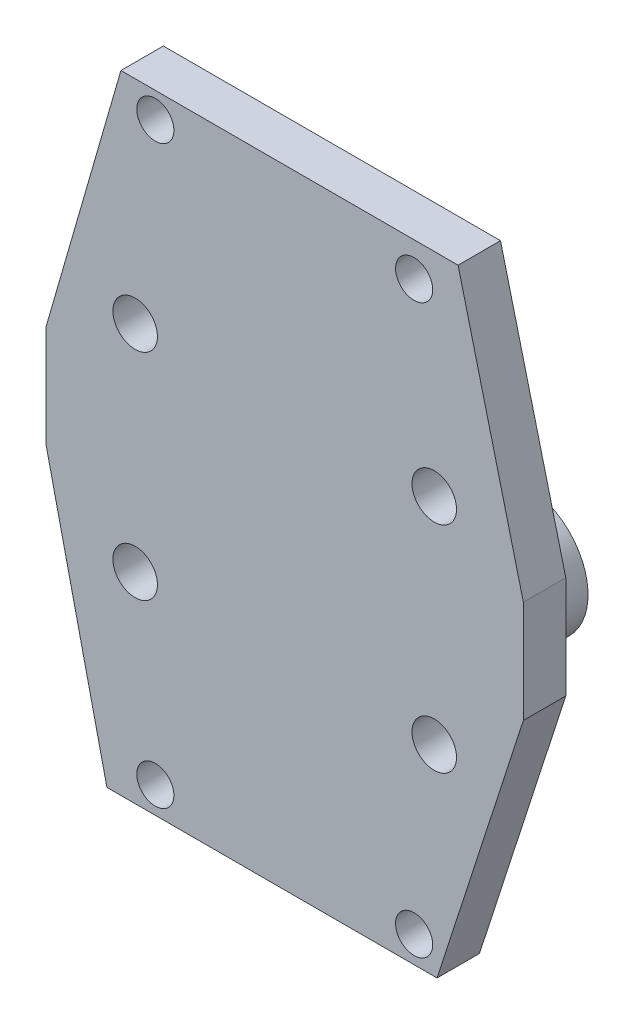
from build123d import *

# Parameters (mm, degrees)
CROQUIS1_W               = 22
CROQUIS1_H               = 55.2
SALIENTE_EXTRUIR1_DEPTH  = 4
CROQUIS2_W               = 12.1
CROQUIS2_H               = 4
CORTAR_EXTRUIR1_DEPTH    = 9.6
CROQUIS3_W               = 12.1
CROQUIS3_H               = 4
CORTAR_EXTRUIR2_DEPTH    = 9.6
CORTAR_EXTRUIR3_DEPTH    = 16
CORTAR_EXTRUIR4_START    = -16
CORTAR_EXTRUIR4_DEPTH    = 16
CROQUIS9_W               = 11.778481694
CROQUIS9_H               = 4
CORTAR_EXTRUIR5_DEPTH    = 2
CROQUIS11_W              = 4.95
CROQUIS11_H              = 4
SALIENTE_EXTRUIR3_DEPTH  = 2
CROQUIS12_W              = 4
CROQUIS12_H              = 1.8
SALIENTE_EXTRUIR4_DEPTH  = 12.1
CROQUIS13_W              = 4.95
CROQUIS13_H              = 4
SALIENTE_EXTRUIR5_DEPTH  = 2
CROQUIS14_W              = 4
CROQUIS14_H              = 1.8
SALIENTE_EXTRUIR6_DEPTH  = 12.1
CROQUIS17_W              = 4
CROQUIS17_H              = 59.2
SALIENTE_EXTRUIR8_DEPTH  = 11.5
CROQUIS18_W              = 4
CROQUIS18_H              = 59.2
SALIENTE_EXTRUIR9_DEPTH  = 11.5
CROQUIS19_R              = 1.75
CORTAR_EXTRUIR6_DEPTH    = 11.5
CORTAR_EXTRUIR7_DEPTH    = 10
CROQUIS27_W              = 12.1
CROQUIS27_H              = 55.6
CORTAR_EXTRUIR8_DEPTH    = 10
CROQUIS28_W              = 12.1
CROQUIS28_H              = 4
SALIENTE_EXTRUIR10_DEPTH = 55.6
SALIENTE_EXTRUIR11_DEPTH = 4.5
CROQUIS30_R              = 2.1
CORTAR_EXTRUIR9_DEPTH    = 10


with BuildPart() as part:
    # Croquis1 → Saliente-Extruir1 (new body)
    with BuildSketch(Plane.XY):
        with Locations((11, 27.6)):
            Rectangle(CROQUIS1_W, CROQUIS1_H)
    extrude(amount=SALIENTE_EXTRUIR1_DEPTH)

    # Croquis2 → Cortar-Extruir1 (cut)
    with BuildSketch(Plane(origin=(0, 55.2, 0), x_dir=(1, 0, 0), z_dir=(0, 1, 0))):
        with Locations((11, -2)):
            Rectangle(CROQUIS2_W, CROQUIS2_H)
    extrude(amount=-CORTAR_EXTRUIR1_DEPTH, mode=Mode.SUBTRACT)

    # Croquis3 → Cortar-Extruir2 (cut)
    with BuildSketch(Plane.XZ):
        with Locations((11, 2)):
            Rectangle(CROQUIS3_W, CROQUIS3_H)
    extrude(amount=-CORTAR_EXTRUIR2_DEPTH, mode=Mode.SUBTRACT)

    # Croquis5 → Cortar-Extruir3 (cut)
    with BuildSketch(Plane.XZ.offset(-9.6)):
        with BuildLine():
            Line((7.4, 4), (14.6, 4))
            ThreePointArc((14.6, 4), (16.401151853, 1.506649462), (17.05, -1.5))
            Line((17.05, -1.5), (4.95, -1.5))
            ThreePointArc((4.95, -1.5), (5.598848147, 1.506649462), (7.4, 4))
        make_face()
    extrude(amount=-CORTAR_EXTRUIR3_DEPTH, mode=Mode.SUBTRACT)

    # Croquis7 → Cortar-Extruir4 (cut)
    with BuildSketch(Plane(origin=(0, 45.6, 0), x_dir=(1, 0, 0), z_dir=(0, 1, 0)).offset(CORTAR_EXTRUIR4_START)):
        with BuildLine():
            Line((4.95, 1.5), (17.05, 1.5))
            ThreePointArc((17.05, 1.5), (16.401151853, -1.506649462), (14.6, -4))
            Line((14.6, -4), (7.4, -4))
            ThreePointArc((7.4, -4), (5.598848147, -1.506649462), (4.95, 1.5))
        make_face()
    extrude(amount=CORTAR_EXTRUIR4_DEPTH, mode=Mode.SUBTRACT)

    # Croquis9 → Cortar-Extruir5 (cut)
    with BuildSketch(Plane(origin=(0, 0, 0), x_dir=(-1, 0, 0), z_dir=(0, 0, -1))):
        with Locations((-11, 27.6)):
            Rectangle(CROQUIS9_W, CROQUIS9_H)
    extrude(amount=-CORTAR_EXTRUIR5_DEPTH, mode=Mode.SUBTRACT)

    # Croquis11 → Saliente-Extruir3 (add)
    with BuildSketch(Plane(origin=(0, 55.2, 0), x_dir=(1, 0, 0), z_dir=(0, 1, 0))):
        with Locations((2.475, -2)):
            Rectangle(CROQUIS11_W, CROQUIS11_H)
        with Locations((19.525, -2)):
            Rectangle(CROQUIS11_W, CROQUIS11_H)
    extrude(amount=SALIENTE_EXTRUIR3_DEPTH)

    # Croquis12 → Saliente-Extruir4 (add)
    with BuildSketch(Plane(origin=(4.95, 0, 0), x_dir=(0, 0, -1), z_dir=(1, 0, 0))):
        with Locations((-2, 56.3)):
            Rectangle(CROQUIS12_W, CROQUIS12_H)
    extrude(amount=SALIENTE_EXTRUIR4_DEPTH)

    # Croquis13 → Saliente-Extruir5 (add)
    with BuildSketch(Plane.XZ):
        with Locations((19.525, 2)):
            Rectangle(CROQUIS13_W, CROQUIS13_H)
        with Locations((2.475, 2)):
            Rectangle(CROQUIS13_W, CROQUIS13_H)
    extrude(amount=SALIENTE_EXTRUIR5_DEPTH)

    # Croquis14 → Saliente-Extruir6 (add)
    with BuildSketch(Plane(origin=(4.95, 0, 0), x_dir=(0, 0, -1), z_dir=(1, 0, 0))):
        with Locations((-2, -1.1)):
            Rectangle(CROQUIS14_W, CROQUIS14_H)
    extrude(amount=SALIENTE_EXTRUIR6_DEPTH)

    # Croquis17 → Saliente-Extruir8 (add)
    with BuildSketch(Plane.ZY):
        with Locations((2, 27.6)):
            Rectangle(CROQUIS17_W, CROQUIS17_H)
    extrude(amount=SALIENTE_EXTRUIR8_DEPTH)

    # Croquis18 → Saliente-Extruir9 (add)
    with BuildSketch(Plane(origin=(22, 0, 0), x_dir=(0, 0, -1), z_dir=(1, 0, 0))):
        with Locations((-2, 27.6)):
            Rectangle(CROQUIS18_W, CROQUIS18_H)
    extrude(amount=SALIENTE_EXTRUIR9_DEPTH)

    # Croquis19 → Cortar-Extruir6 (cut)
    with BuildSketch(Plane(origin=(0, 0, 0), x_dir=(-1, 0, 0), z_dir=(0, 0, -1))):
        with Locations((-23.2, 54)):
            Circle(CROQUIS19_R)
        with Locations((1.2, 54.8)):
            Circle(CROQUIS19_R)
        with Locations((1.2, 0.5)):
            Circle(CROQUIS19_R)
        with Locations((-23.2, 0.5)):
            Circle(CROQUIS19_R)
    extrude(amount=-CORTAR_EXTRUIR6_DEPTH, mode=Mode.SUBTRACT)

    # Croquis21 → Cortar-Extruir7 (cut)
    with BuildSketch(Plane(origin=(0, 0, 0), x_dir=(-1, 0, 0), z_dir=(0, 0, -1))):
        Polygon((-27.345452568, 57.2), (-33.5, 32.755874525), (-33.5, 57.2), align=None)
        Polygon((4.445660904, 57.2), (11.5, 32.755874525), (11.5, 57.2), align=None)
        Polygon((-25.363668871, -2), (-33.5, 23.094679002), (-33.5, -2), align=None)
        Polygon((11.5, 23.094679002), (5.766850036, -2), (11.5, -2), align=None)
    extrude(amount=-CORTAR_EXTRUIR7_DEPTH, mode=Mode.SUBTRACT)

    # Croquis27 → Cortar-Extruir8 (cut)
    with BuildSketch(Plane(origin=(0, 0, 0), x_dir=(-1, 0, 0), z_dir=(0, 0, -1))):
        with Locations((-11, 27.6)):
            Rectangle(CROQUIS27_W, CROQUIS27_H)
    extrude(amount=-CORTAR_EXTRUIR8_DEPTH, mode=Mode.SUBTRACT)

    # Croquis28 → Saliente-Extruir10 (add)
    with BuildSketch(Plane.XZ.offset(-55.4)):
        with Locations((11, 2)):
            Rectangle(CROQUIS28_W, CROQUIS28_H)
    extrude(amount=SALIENTE_EXTRUIR10_DEPTH)

    # Croquis29 → Saliente-Extruir11 (add)
    with BuildSketch(Plane(origin=(0, 0, 0), x_dir=(-1, 0, 0), z_dir=(0, 0, -1))):
        with BuildLine():
            Line((-21.25, 32.527178544), (-21.25, 23.323374983))
            ThreePointArc((-21.25, 23.323374983), (-31.1, 27.925276764), (-21.25, 32.527178544))
        make_face()
        with BuildLine():
            Line((-1.112987938, 23.653189144), (-1.112987938, 32.197364384))
            ThreePointArc((-1.112987938, 32.197364384), (9.1, 27.925276764), (-1.112987938, 23.653189144))
        make_face()
    extrude(amount=SALIENTE_EXTRUIR11_DEPTH)

    # Croquis25 → Cortar-Revolución3 (revolve, cut)
    with BuildSketch(Plane(origin=(0, 0, -7.5), x_dir=(-1, 0, 0), z_dir=(0, 0, -1))):
        with BuildLine():
            Line((-25.1, 22.925276764), (-25.1, 32.925276764))
            ThreePointArc((-25.1, 32.925276764), (-30.1, 27.925276764), (-25.1, 22.925276764))
        make_face()
    revolve(axis=Axis((25.1, 22.925276764, -7.5), (0, 1, 0)), mode=Mode.SUBTRACT)

    # Croquis26 → Cortar-Revolución4 (revolve, cut)
    with BuildSketch(Plane(origin=(0, 0, -7.5), x_dir=(-1, 0, 0), z_dir=(0, 0, -1))):
        with BuildLine():
            Line((3.1, 32.925276764), (3.1, 22.925276764))
            ThreePointArc((3.1, 22.925276764), (8.1, 27.925276764), (3.1, 32.925276764))
        make_face()
    revolve(axis=Axis((-3.1, 32.925276764, -7.5), (0, -1, 0)), mode=Mode.SUBTRACT)

    # Croquis30 → Cortar-Extruir9 (cut)
    with BuildSketch(Plane(origin=(0, 0, 0), x_dir=(-1, 0, 0), z_dir=(0, 0, -1))):
        with Locations((-25.1, 37.194789274)):
            Circle(CROQUIS30_R)
        with Locations((-25.1, 16.925277734)):
            Circle(CROQUIS30_R)
        with Locations((3.1, 37.194789274)):
            Circle(CROQUIS30_R)
        with Locations((3.1, 16.925277734)):
            Circle(CROQUIS30_R)
    extrude(amount=-CORTAR_EXTRUIR9_DEPTH, mode=Mode.SUBTRACT)


solid = part.part
